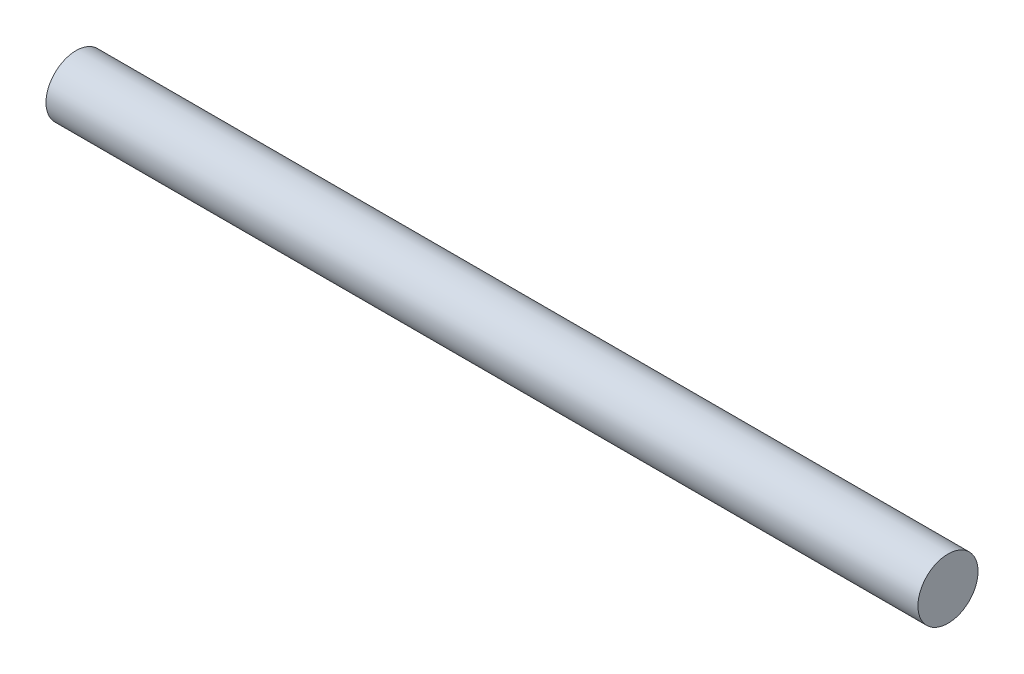
from build123d import *

# Parameters (mm, degrees)
SKETCH_1_R      = 1
EXTRUDE_1_DEPTH = 14.5


with BuildPart() as part:
    # Эскиз1 → Бобышка-Вытянуть1 (new, symmetric)
    with BuildSketch(Plane(origin=(0, 0, 0), x_dir=(0, 0, -1), z_dir=(1, 0, 0))):
        with Locations(Location((0, 0, 0), (0, 0, 180))):
            Circle(SKETCH_1_R)
    extrude(amount=EXTRUDE_1_DEPTH, both=True)


solid = part.part
